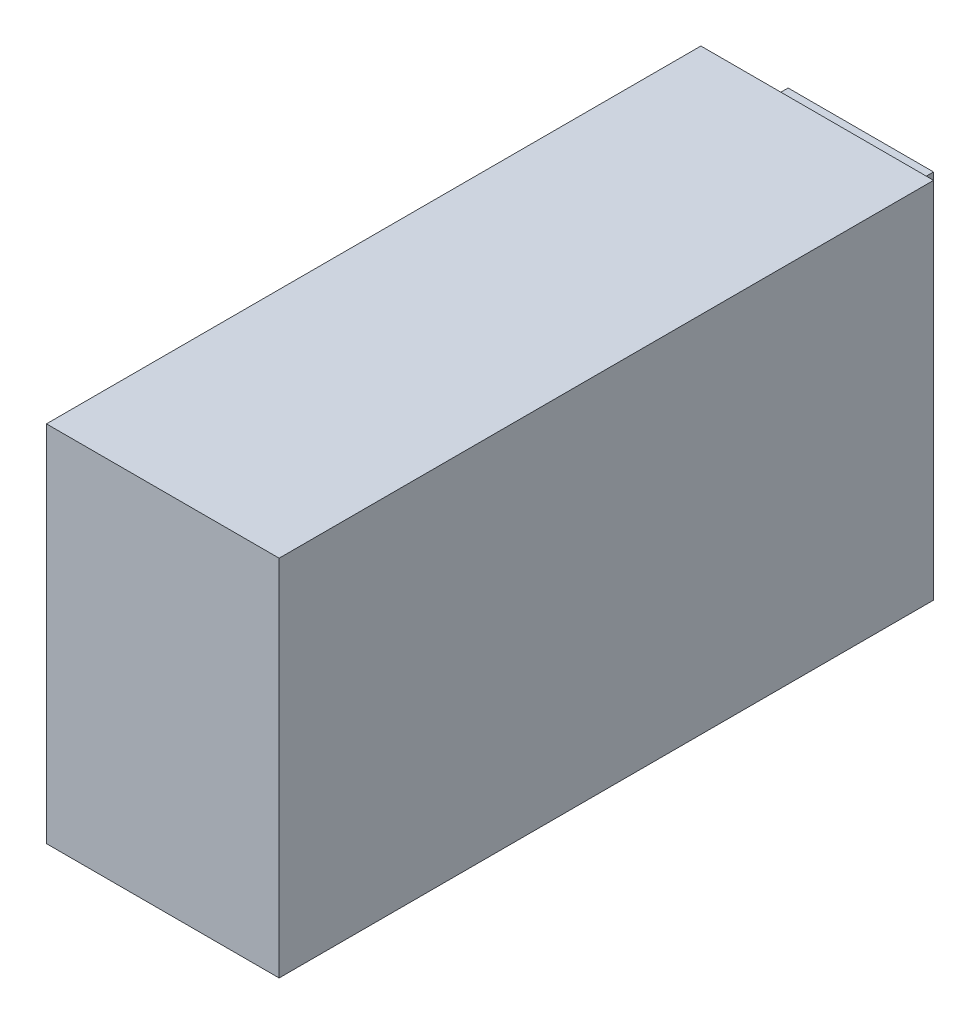
from build123d import *

# Parameters (mm, degrees)
SKETCH1_W           = 16
SKETCH1_H           = 45
BOSS_EXTRUDE1_DEPTH = 25
SKETCH2_W           = 10
SKETCH2_H           = 20
BOSS_EXTRUDE2_DEPTH = 3


with BuildPart() as part:
    # Sketch1 → Boss-Extrude1 (new body)
    with BuildSketch(Plane(origin=(0, 0, 0), x_dir=(1, 0, 0), z_dir=(0, 1, 0))):
        with Locations((8, 22.5)):
            Rectangle(SKETCH1_W, SKETCH1_H)
    extrude(amount=BOSS_EXTRUDE1_DEPTH)

    # Sketch2 → Boss-Extrude2 (add)
    with BuildSketch(Plane(origin=(0, 0, -45), x_dir=(-1, 0, 0), z_dir=(0, 0, -1))):
        with Locations((-8, 12.5)):
            Rectangle(SKETCH2_W, SKETCH2_H)
    extrude(amount=BOSS_EXTRUDE2_DEPTH)


solid = part.part
